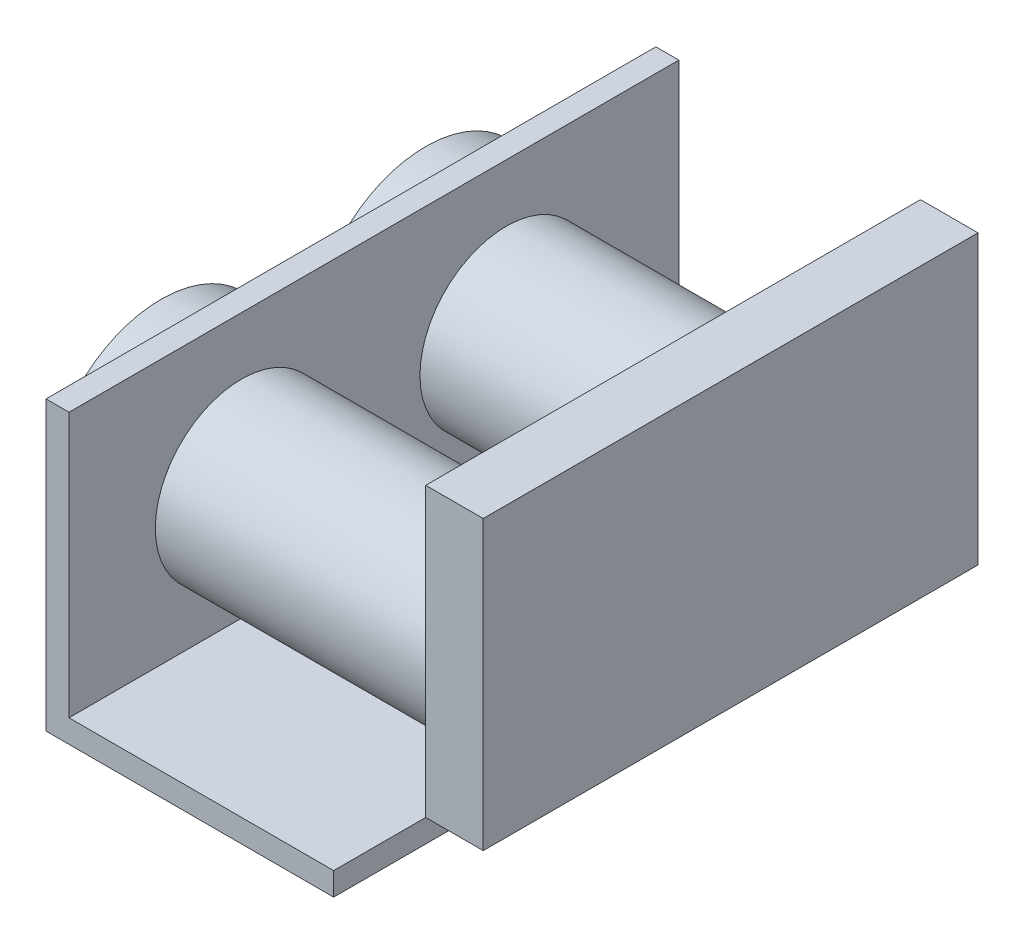
from build123d import *

# Parameters (mm, degrees)
EXTRUDE_THIN1_DEPTH = 53
SKETCH2_R           = 10
BOSS_EXTRUDE1_DEPTH = 5
SKETCH4_R           = 7.5
BOSS_EXTRUDE2_DEPTH = 33
SKETCH5_W           = 43
SKETCH5_H           = 25
BOSS_EXTRUDE3_DEPTH = 5
SKETCH6_R           = 1.5
CUT_EXTRUDE1_DEPTH  = 5


with BuildPart() as part:
    # Sketch1 → Extrude-Thin1 (new body)
    with BuildSketch(Plane.XY):
        Polygon((0, 25), (0, 0), (25, 0), (25, 2), (2, 2), (2, 25), align=None)
    extrude(amount=EXTRUDE_THIN1_DEPTH)

    # Sketch2 → Boss-Extrude1 (add)
    with BuildSketch(Plane.ZY):
        with Locations((15, 12.5)):
            Circle(SKETCH2_R)
        with Locations((38, 12.5)):
            Circle(SKETCH2_R)
    extrude(amount=BOSS_EXTRUDE1_DEPTH)

    # Sketch4 → Boss-Extrude2 (add)
    with BuildSketch(Plane.ZY.offset(5)):
        with Locations((38, 12.5)):
            Circle(SKETCH4_R)
        with Locations((15, 12.5)):
            Circle(SKETCH4_R)
    extrude(amount=-BOSS_EXTRUDE2_DEPTH)

    # Sketch5 → Boss-Extrude3 (add)
    with BuildSketch(Plane(origin=(28, 0, 0), x_dir=(0, 0, -1), z_dir=(1, 0, 0))):
        with Locations((-26.5, 17.5)):
            Rectangle(SKETCH5_W, SKETCH5_H)
    extrude(amount=BOSS_EXTRUDE3_DEPTH)

    # Sketch6 → Cut-Extrude1 (cut)
    with BuildSketch(Plane.XZ):
        with Locations(Location((15, 26.5, 0), (0, 0, 270))):
            Circle(SKETCH6_R)
    extrude(amount=-CUT_EXTRUDE1_DEPTH, mode=Mode.SUBTRACT)


solid = part.part
